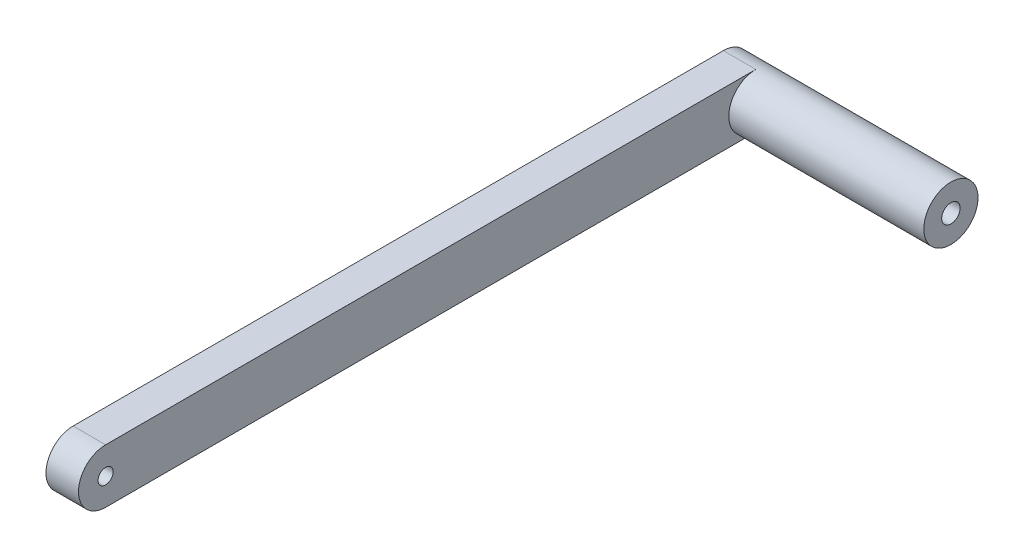
from build123d import *

# Parameters (mm, degrees)
RESSALTO_EXTRUS_O1_DEPTH = 3
ESBO_O2_R                = 2.5
RESSALTO_EXTRUS_O2_DEPTH = 18
ESBO_O3_R                = 0.85
CORTE_EXTRUS_O1_DEPTH    = 39.774991941
ESBO_O4_R                = 0.7
CORTE_EXTRUS_O2_DEPTH    = 38.235735524


with BuildPart() as part:
    # Esboço1 → Ressalto-extrusão1 (new body)
    with BuildSketch(Plane(origin=(0, 0, 0), x_dir=(0, 0, -1), z_dir=(1, 0, 0))):
        with BuildLine():
            Line((-30, 2.5), (30, 2.5))
            ThreePointArc((30, 2.5), (32.5, 0), (30, -2.5))
            Line((30, -2.5), (-30, -2.5))
            ThreePointArc((-30, -2.5), (-32.5, 0), (-30, 2.5))
        make_face()
    extrude(amount=RESSALTO_EXTRUS_O1_DEPTH)

    # Esboço2 → Ressalto-extrusão2 (add)
    with BuildSketch(Plane(origin=(3, 0, 0), x_dir=(0, 0, -1), z_dir=(1, 0, 0))):
        with Locations(Location((30, 0, 0), (0, 0, 90))):
            Circle(ESBO_O2_R)
    extrude(amount=RESSALTO_EXTRUS_O2_DEPTH)

    # Esboço3 → Corte-extrusão1 (cut, through all)
    with BuildSketch(Plane(origin=(21, 0, 0), x_dir=(0, 0, -1), z_dir=(1, 0, 0))):
        with Locations((30, 0)):
            Circle(ESBO_O3_R)
    extrude(amount=-CORTE_EXTRUS_O1_DEPTH, mode=Mode.SUBTRACT)

    # Esboço4 → Corte-extrusão2 (cut, through all)
    with BuildSketch(Plane(origin=(3, 0, 0), x_dir=(0, 0, -1), z_dir=(1, 0, 0))):
        with Locations((-30, 0)):
            Circle(ESBO_O4_R)
    extrude(amount=-CORTE_EXTRUS_O2_DEPTH, mode=Mode.SUBTRACT)


solid = part.part
